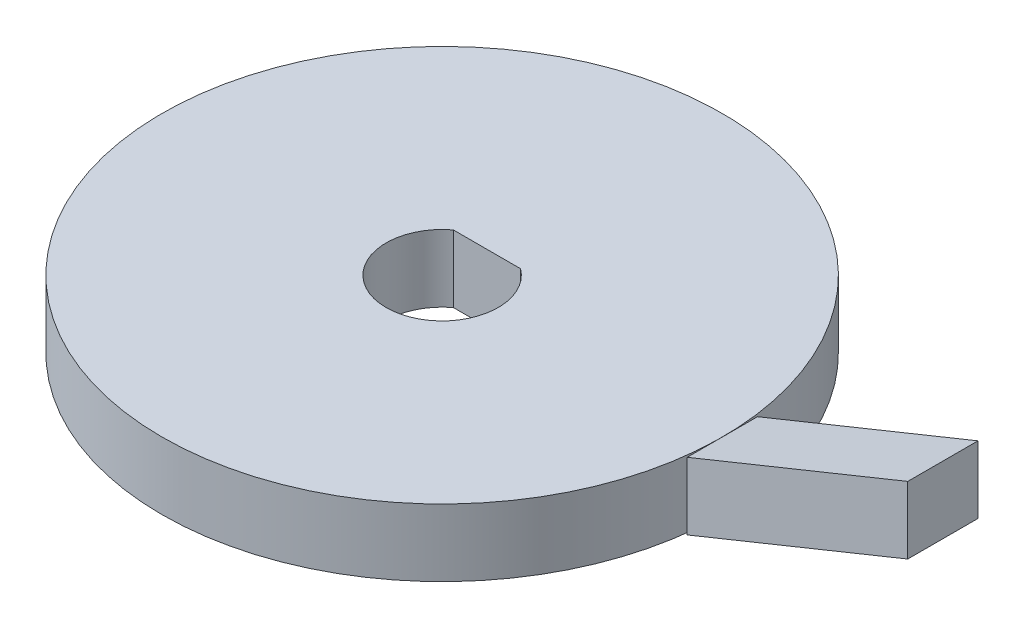
from build123d import *

# Parameters (mm, degrees)
SKETCH1_R           = 12.5
BOSS_EXTRUDE1_DEPTH = 1.5
SKETCH3_W           = 3.134627122
SKETCH3_H           = 3


with BuildPart() as part:
    # Sketch1 → Boss-Extrude1 (new, symmetric)
    with BuildSketch(Plane(origin=(0, 0, 0), x_dir=(1, 0, 0), z_dir=(0, 1, 0))):
        with Locations(Location((0, 0, 0), (0, 0, 270))):
            Circle(SKETCH1_R)
        with BuildLine():
            Line((-1.5, 2), (1.5, 2))
            ThreePointArc((1.5, 2), (0, -2.5), (-1.5, 2))
        make_face(mode=Mode.SUBTRACT)
    extrude(amount=BOSS_EXTRUDE1_DEPTH, both=True)


with BuildPart() as body_2:
    # Sweep2: sweep along a path in Sketch2
    with BuildLine(Plane.XY) as sweep2_path:
        Line((12.5, 0), (22.336176394, 3.986535257))
    # Sketch3 → Sweep2 (sweep)
    with BuildSketch(Plane(origin=(12.5, 0, 0), x_dir=(0, 0, -1), z_dir=(1, 0, 0))):
        Rectangle(SKETCH3_W, SKETCH3_H)
    sweep(path=sweep2_path.line)


solid = Compound([part.part, body_2.part])
